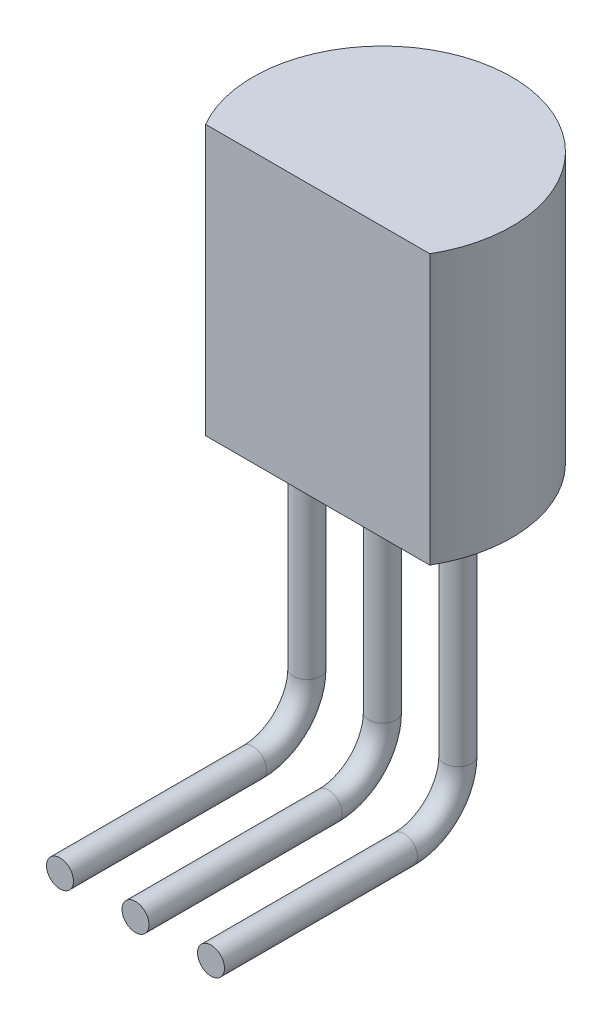
from build123d import *

# Parameters (mm, degrees)
EXTRUSION1_DEPTH = 5
ESQUISSE6_R      = 0.25


with BuildPart() as part:
    # Esquisse2 → Extrusion1 (new body)
    with BuildSketch(Plane(origin=(0, 0, 0), x_dir=(1, 0, 0), z_dir=(0, 1, 0))):
        with BuildLine():
            Line((-2.078460969, -1.2), (2.078460969, -1.2))
            ThreePointArc((2.078460969, -1.2), (0, 2.4), (-2.078460969, -1.2))
        make_face()
    extrude(amount=EXTRUSION1_DEPTH)

    # Balayage1: sweep along a path in Esquisse8
    with BuildLine(Plane(origin=(0, 0, 0), x_dir=(0, 0, -1), z_dir=(1, 0, 0))) as balayage1_path:
        Line((0, 0), (0, -4))
        ThreePointArc((0, -4), (-0.292893219, -4.707106781), (-1, -5))
        Line((-1, -5), (-4.578130226, -5))
    # Esquisse6 → Balayage1 (sweep)
    with BuildSketch(Plane.XZ):
        Circle(ESQUISSE6_R)
        with Locations((1.4, 0)):
            Circle(ESQUISSE6_R)
        with Locations((-1.4, 0)):
            Circle(ESQUISSE6_R)
    sweep(path=balayage1_path.line)


solid = part.part
